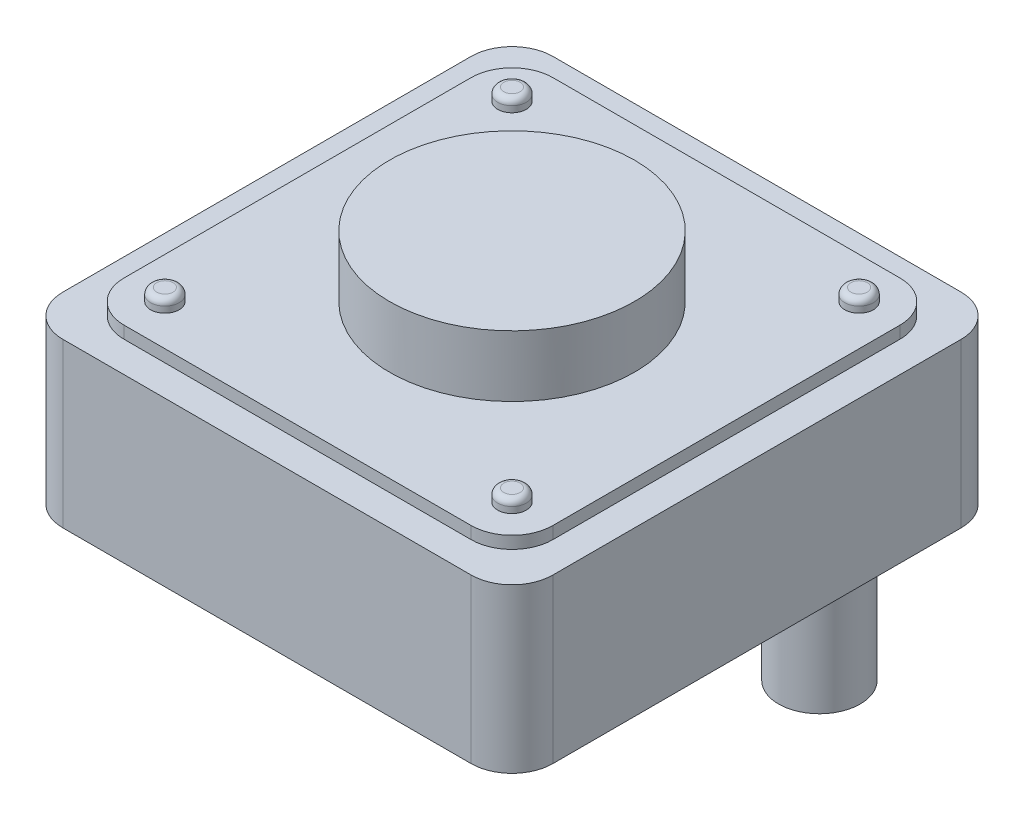
from build123d import *

# Parameters (mm, degrees)
BOSS_EXTRUDE1_DEPTH = 4
BOSS_EXTRUDE2_DEPTH = 0.3
SKETCH3_R           = 0.35
BOSS_EXTRUDE3_DEPTH = 0.3
FILLET2_R           = 0.15
FILLET3_R           = 0.15
SKETCH4_R           = 3
BOSS_EXTRUDE4_DEPTH = 1.5
SKETCH5_R           = 1
BOSS_EXTRUDE5_DEPTH = 5


with BuildPart() as part:
    # Sketch1 → Boss-Extrude1 (new body)
    with BuildSketch(Plane(origin=(0, 0, 0), x_dir=(1, 0, 0), z_dir=(0, 1, 0))):
        with BuildLine():
            Line((-5, 6), (5, 6))
            ThreePointArc((5, 6), (5.707106781, 5.707106781), (6, 5))
            Line((6, 5), (6, -5))
            ThreePointArc((6, -5), (5.707106781, -5.707106781), (5, -6))
            Line((5, -6), (-5, -6))
            ThreePointArc((-5, -6), (-5.707106781, -5.707106781), (-6, -5))
            Line((-6, -5), (-6, 5))
            ThreePointArc((-6, 5), (-5.707106781, 5.707106781), (-5, 6))
        make_face()
    extrude(amount=BOSS_EXTRUDE1_DEPTH)

    # Sketch2 → Boss-Extrude2 (add)
    with BuildSketch(Plane(origin=(0, 4, 0), x_dir=(1, 0, 0), z_dir=(0, 1, 0))):
        with BuildLine():
            Line((-4.25, 5.25), (4.25, 5.25))
            ThreePointArc((4.25, 5.25), (4.957106781, 4.957106781), (5.25, 4.25))
            Line((5.25, 4.25), (5.25, -4.25))
            ThreePointArc((5.25, -4.25), (4.957106781, -4.957106781), (4.25, -5.25))
            Line((4.25, -5.25), (-4.25, -5.25))
            ThreePointArc((-4.25, -5.25), (-4.957106781, -4.957106781), (-5.25, -4.25))
            Line((-5.25, -4.25), (-5.25, 4.25))
            ThreePointArc((-5.25, 4.25), (-4.957106781, 4.957106781), (-4.25, 5.25))
        make_face()
    extrude(amount=BOSS_EXTRUDE2_DEPTH)

    # Sketch3 → Boss-Extrude3 (add)
    with BuildSketch(Plane(origin=(0, 4.3, 0), x_dir=(1, 0, 0), z_dir=(0, 1, 0))):
        with Locations(Location((4.25, 4.25, 0), (0, 0, 90))):
            Circle(SKETCH3_R)
        with Locations(Location((4.25, -4.25, 0), (0, 0, 90))):
            Circle(SKETCH3_R)
        with Locations(Location((-4.25, -4.25, 0), (0, 0, 90))):
            Circle(SKETCH3_R)
        with Locations(Location((-4.25, 4.25, 0), (0, 0, 90))):
            Circle(SKETCH3_R)
    extrude(amount=BOSS_EXTRUDE3_DEPTH)

    # Fillet2
    fillet2_edges = [part.edges().sort_by_distance(p)[0] for p in [
        (-4.25, 4.6, -3.9),
    ]]
    fillet(fillet2_edges, radius=FILLET2_R)

    # Fillet3
    fillet3_edges = [part.edges().sort_by_distance(p)[0] for p in [
        (4.25, 4.6, -3.9),
        (4.25, 4.6, 4.6),
        (-4.25, 4.6, 4.6),
    ]]
    fillet(fillet3_edges, radius=FILLET3_R)

    # Sketch4 → Boss-Extrude4 (add)
    with BuildSketch(Plane(origin=(0, 4.3, 0), x_dir=(1, 0, 0), z_dir=(0, 1, 0))):
        with Locations(Location((0, 0, 0), (0, 0, 90))):
            Circle(SKETCH4_R)
    extrude(amount=BOSS_EXTRUDE4_DEPTH)

    # Sketch5 → Boss-Extrude5 (add)
    with BuildSketch(Plane.XZ):
        with Locations(Location((2.5, -5.027876242, 0), (0, 0, 256.439715219))):
            Circle(SKETCH5_R)
        with Locations(Location((-2.5, -5.027876242, 0), (0, 0, 90))):
            Circle(SKETCH5_R)
    extrude(amount=BOSS_EXTRUDE5_DEPTH)


solid = part.part
